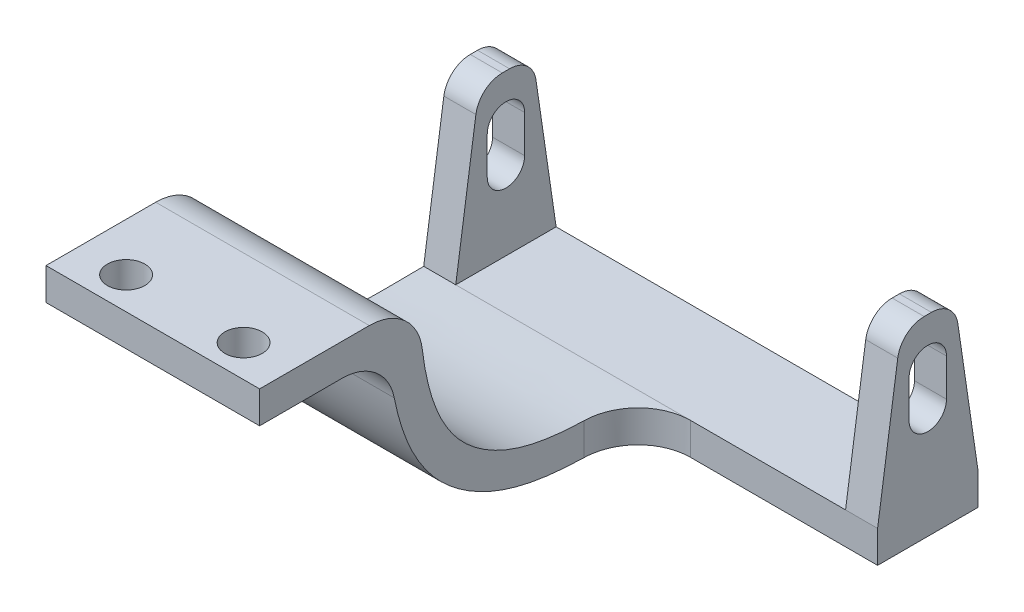
from build123d import *

# Parameters (mm, degrees)
SKETCH_2_W          = 42.5
SKETCH_2_H          = 9.4
EXTRUDE_1_DEPTH     = 3
SKETCH_3_W          = 3
SKETCH_3_H          = 9.4
EXTRUDE_2_DEPTH     = 15
CUT_EXTRUDE_3_DEPTH = 47.393318484
CUT_EXTRUDE_4_DEPTH = 47.393318484
FILLET_2_R          = 2.5
EXTRUDE_5_DEPTH     = 20
SKETCH_12_W         = 20
SKETCH_12_H         = 15
EXTRUDE_6_DEPTH     = 3
FILLET_3_R          = 5
SKETCH_13_R         = 1.75
CUT_EXTRUDE_5_DEPTH = 49.708304406
FILLET_4_R          = 5


with BuildPart() as part:
    # 草图2 → 凸台-拉伸1 (new body)
    with BuildSketch(Plane(origin=(0, 0, 0), x_dir=(1, 0, 0), z_dir=(0, 1, 0))):
        Rectangle(SKETCH_2_W, SKETCH_2_H)
    extrude(amount=EXTRUDE_1_DEPTH)

    # 草图3 → 凸台-拉伸2 (add)
    with BuildSketch(Plane(origin=(0, 3, 0), x_dir=(1, 0, 0), z_dir=(0, 1, 0))):
        with Locations((-19.75, 0)):
            Rectangle(SKETCH_3_W, SKETCH_3_H)
        with Locations((19.75, 0)):
            Rectangle(SKETCH_3_W, SKETCH_3_H)
    extrude(amount=EXTRUDE_2_DEPTH)

    # 草图7 → 切除-拉伸3 (cut, through all)
    with BuildSketch(Plane(origin=(21.25, 0, 0), x_dir=(0, 0, -1), z_dir=(1, 0, 0))):
        with BuildLine():
            Line((1.75, 13.75), (1.75, 10.25))
            ThreePointArc((1.75, 10.25), (0, 8.5), (-1.75, 10.25))
            Line((-1.75, 10.25), (-1.75, 13.75))
            ThreePointArc((-1.75, 13.75), (0, 15.5), (1.75, 13.75))
        make_face()
    extrude(amount=-CUT_EXTRUDE_3_DEPTH, mode=Mode.SUBTRACT)

    # 草图8 → 切除-拉伸4 (cut, through all)
    with BuildSketch(Plane(origin=(21.25, 0, 0), x_dir=(0, 0, -1), z_dir=(1, 0, 0))):
        Polygon((-4.7, 3), (-2.5, 18), (-2.5, 19), (2.5, 19), (2.5, 18), (4.7, 3), (5.7, 3), (5.7, 21), (-5.7, 21), (-5.7, 3), align=None)
    extrude(amount=-CUT_EXTRUDE_4_DEPTH, mode=Mode.SUBTRACT)

    # 圆角2
    fillet_2_edges = [part.edges().sort_by_distance(p)[0] for p in [
        (19.75, 18, 2.5),
        (19.75, 18, -2.5),
        (-19.75, 18, 2.5),
        (-19.75, 18, -2.5),
    ]]
    fillet(fillet_2_edges, radius=FILLET_2_R)

    # 草图11 → 凸台-拉伸5 (add)
    with BuildSketch(Plane.ZY.offset(21.25)):
        with BuildLine():
            Line((4.7, 0), (4.7, 3))
            add(Edge.make_bspline(
                [(4.7, 3), (6.962486025, 3), (10.1417855, 2.862932252), (16.337474526, 3.528245294), (24.23161516, 8.297891954), (25.062946505, 16.379576905), (25.062946505, 20.743946169)],
                knots=[0, 0, 0, 0, 0.173642334, 0.358241977, 0.55622398, 1, 1, 1, 1], degree=3))
            Line((25.062946505, 20.743946169), (28.062946505, 20.743946169))
            add(Edge.make_bspline(
                [(4.7, 0), (5.076993719, 0), (5.855225367, -0.004193676), (7.217639973, -0.020495438), (8.810719384, -0.039341399), (10.76734867, 0.000672168), (12.947992739, 0.170949768), (15.24934878, 0.54571413), (17.628276305, 1.229289778), (19.903594775, 2.272660667), (21.99790066, 3.662053242), (23.859207745, 5.447000714), (25.7878767, 8.220055058), (26.937595088, 11.247139627), (27.595828159, 14.298246056), (27.892483676, 16.554104562), (28.014441837, 18.363930093), (28.056904435, 19.75444003), (28.062946505, 20.410858245), (28.062946505, 20.743946169)],
                knots=[0, 0, 0, 0, 0.03125, 0.0625, 0.125, 0.1875, 0.25, 0.3125, 0.375, 0.4375, 0.5, 0.5625, 0.625, 0.75, 0.8125, 0.875, 0.9375, 0.96875, 1, 1, 1, 1], degree=3))
        make_face()
    extrude(amount=-EXTRUDE_5_DEPTH)

    # 草图12 → 凸台-拉伸6 (add)
    with BuildSketch(Plane(origin=(0, 20.743946169, 0), x_dir=(1, 0, 0), z_dir=(0, 1.0, 2.3592378051162655e-12))):
        with Locations((-11.25, -32.562946505)):
            Rectangle(SKETCH_12_W, SKETCH_12_H)
    extrude(amount=-EXTRUDE_6_DEPTH)

    # 圆角3
    fillet_3_edges = [part.edges().sort_by_distance(p)[0] for p in [
        (-11.25, 17.743946169, 27.967624868),
        (-11.25, 20.743946169, 25.062946505),
    ]]
    fillet(fillet_3_edges, radius=FILLET_3_R)

    # 草图13 → 切除-拉伸5 (cut, through all)
    with BuildSketch(Plane.XZ.offset(-17.743946169)):
        with Locations(Location((-5.75, 37.062946505, 0), (0, 0, 270))):
            Circle(SKETCH_13_R)
        with Locations(Location((-16.75, 37.062946505, 0), (0, 0, 90))):
            Circle(SKETCH_13_R)
    extrude(amount=-CUT_EXTRUDE_5_DEPTH, mode=Mode.SUBTRACT)

    # 圆角4
    fillet_4_edges = [part.edges().sort_by_distance(p)[0] for p in [
        (-1.25, 1.5, 4.7),
    ]]
    fillet(fillet_4_edges, radius=FILLET_4_R)


solid = part.part
